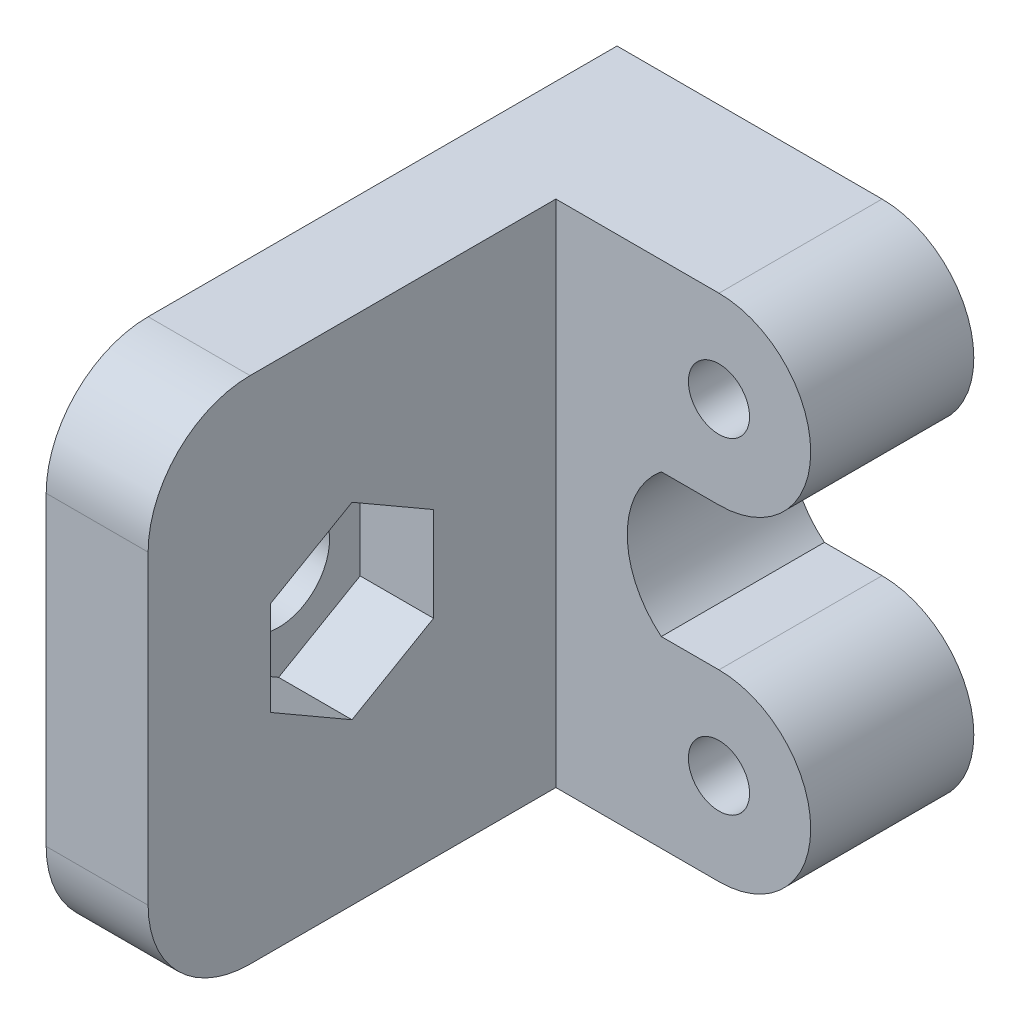
from build123d import *

# Parameters (mm, degrees)
CROQUIS1_R              = 1.5
SALIENTE_EXTRUIR1_DEPTH = 8
CROQUIS2_W              = 5
CROQUIS2_H              = 25
SALIENTE_EXTRUIR2_DEPTH = 20
CROQUIS3_R              = 2.5
CORTAR_EXTRUIR1_DEPTH   = 20
CORTAR_EXTRUIR2_DEPTH   = 3.6
REDONDEO1_R             = 5


with BuildPart() as part:
    # Croquis1 → Saliente-Extruir1 (new body)
    with BuildSketch(Plane.XY):
        with BuildLine():
            Line((-13, 20.5), (0, 20.5))
            ThreePointArc((0, 20.5), (4.5, 16), (0, 11.5))
            Line((0, 11.5), (-2.828427125, 11.5))
            ThreePointArc((-2.828427125, 11.5), (-4.5, 8), (-2.828427125, 4.5))
            Line((-2.828427125, 4.5), (0, 4.5))
            ThreePointArc((0, 4.5), (4.5, 0), (0, -4.5))
            Line((0, -4.5), (-13, -4.5))
            Line((-13, -4.5), (-13, 20.5))
        make_face()
        Circle(CROQUIS1_R, mode=Mode.SUBTRACT)
        with Locations((0, 16)):
            Circle(CROQUIS1_R, mode=Mode.SUBTRACT)
    extrude(amount=SALIENTE_EXTRUIR1_DEPTH)

    # Croquis2 → Saliente-Extruir2 (add)
    with BuildSketch(Plane.XY.offset(8)):
        with Locations((-10.5, 8)):
            Rectangle(CROQUIS2_W, CROQUIS2_H)
    extrude(amount=SALIENTE_EXTRUIR2_DEPTH)

    # Croquis3 → Cortar-Extruir1 (cut)
    with BuildSketch(Plane(origin=(-8, 0, 0), x_dir=(0, 0, -1), z_dir=(1, 0, 0))):
        with Locations((-18, 8)):
            Circle(CROQUIS3_R)
    extrude(amount=-CORTAR_EXTRUIR1_DEPTH, mode=Mode.SUBTRACT)

    # Croquis4 → Cortar-Extruir2 (cut)
    with BuildSketch(Plane(origin=(-8, 0, 0), x_dir=(0, 0, -1), z_dir=(1, 0, 0))):
        Polygon((-18, 3.381197846), (-14, 5.690598923), (-14, 10.309401077), (-18, 12.618802154), (-22, 10.309401077), (-22, 5.690598923), align=None)
    extrude(amount=-CORTAR_EXTRUIR2_DEPTH, mode=Mode.SUBTRACT)

    # Redondeo1
    redondeo1_edges = [part.edges().sort_by_distance(p)[0] for p in [
        (-10.5, -4.5, 28),
        (-10.5, 20.5, 28),
    ]]
    fillet(redondeo1_edges, radius=REDONDEO1_R)


solid = part.part
